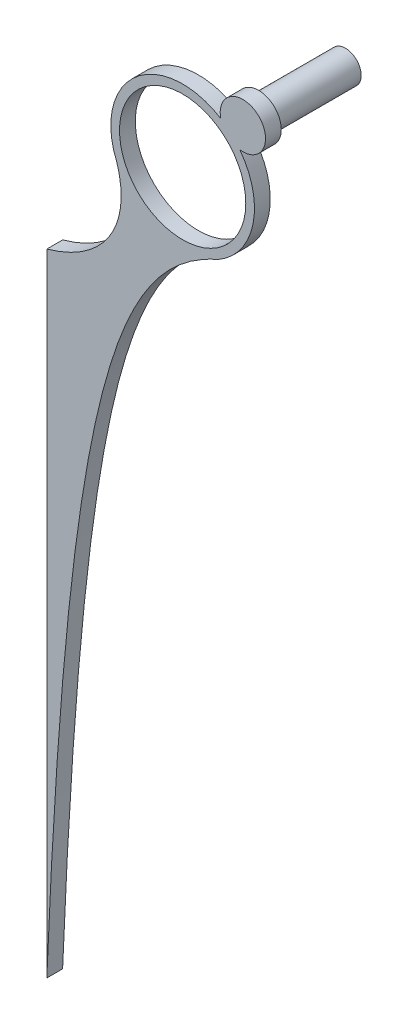
from build123d import *

# Parameters (mm, degrees)
SKETCH_1_R      = 8
EXTRUDE_1_DEPTH = 2
SKETCH_4_R      = 2
EXTRUDE_3_DEPTH = 11
SKETCH_5_R      = 2.870898962
EXTRUDE_4_DEPTH = 2


with BuildPart() as part:
    # 草图1 → 凸台-拉伸1 (new body)
    with BuildSketch(Plane.XY):
        with BuildLine():
            add(Edge.make_bspline(
                [(0, 0), (7.619140502, 2.152110585), (10.835651992, 7.883222637), (8.845016995, 14.036127647)],
                knots=[0, 0, 0, 0, 1, 1, 1, 1], degree=3))
            Line((0, 0), (0, -80))
            add(Edge.make_bspline(
                [(0, -80), (2.767736812, -12.982453188), (8.848199723, 4.119657414), (21.705777592, 9.705463364)],
                knots=[0, 0, 0, 0, 1, 1, 1, 1], degree=3))
            ThreePointArc((21.705777592, 9.705463364), (20.116416659, 26.247156045), (8.845016995, 14.036127647))
        make_face()
        with Locations((17.211642927, 17.620858295)):
            Circle(SKETCH_1_R, mode=Mode.SUBTRACT)
    extrude(amount=EXTRUDE_1_DEPTH)

    # 草图5 → 凸台-拉伸4 (add)
    with BuildSketch(Plane(origin=(0, 0, 0), x_dir=(-1, 0, 0), z_dir=(0, 0, -1))):
        with Locations((-24.840299444, 25.964534935)):
            Circle(SKETCH_5_R)
    extrude(amount=-EXTRUDE_4_DEPTH)


with BuildPart() as body_2:
    # 草图4 → 凸台-拉伸3 (new body)
    with BuildSketch(Plane(origin=(0, 0, 0), x_dir=(-1, 0, 0), z_dir=(0, 0, -1))):
        with Locations((-24.84029944, 25.96453493)):
            Circle(SKETCH_4_R)
    extrude(amount=EXTRUDE_3_DEPTH)


solid = Compound([part.part, body_2.part])
